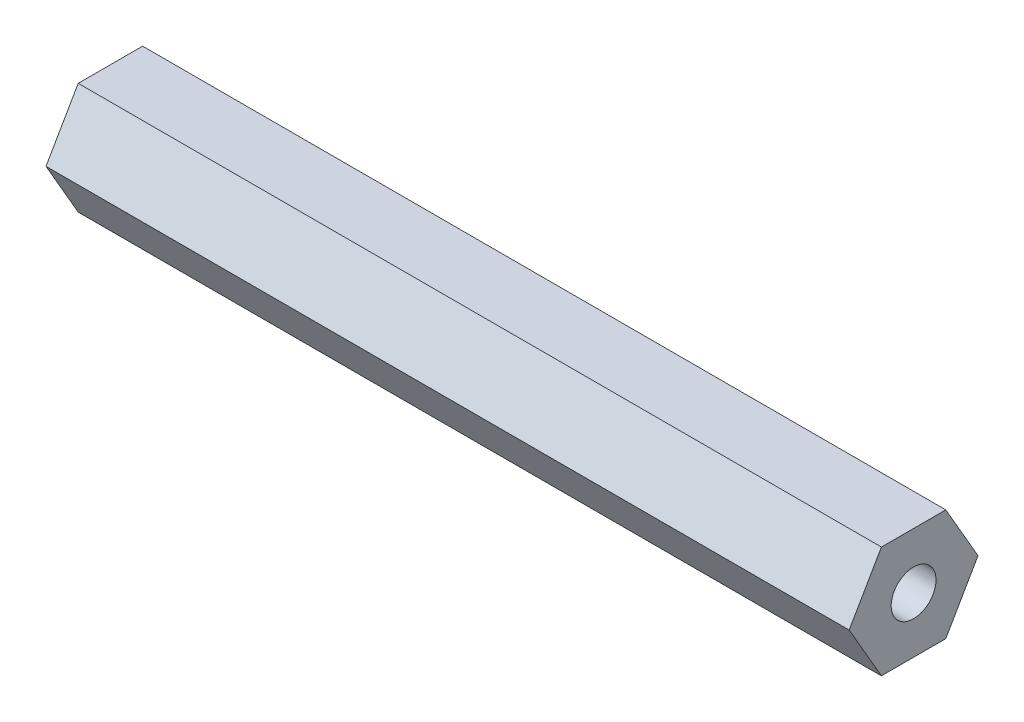
from build123d import *

# Parameters (mm, degrees)
BOSS_EXTRUDE1_DEPTH = 91.44


with BuildPart() as part:
    # Sketch1 → Boss-Extrude1 (new body)
    with BuildSketch(Plane(origin=(0, 0, 0), x_dir=(0, 0, -1), z_dir=(1, 0, 0))):
        Polygon((7.332348419, 0), (3.666174209, 6.35), (-3.666174209, 6.35), (-7.332348419, 0), (-3.666174209, -6.35), (3.666174209, -6.35), align=None)
    extrude(amount=BOSS_EXTRUDE1_DEPTH)

    # Sketch3 → Tap Drill for 1/4-20 Tap1 (revolve, cut)
    with BuildSketch(Plane.ZX):
        Polygon((0, 0), (0, 14.233816902), (2.5527, 12.7), (2.5527, 0), align=None)
    tap_drill_for_1_4_20_tap1 = revolve(axis=Axis((-6.35, 0, 0), (1, 0, 0)), mode=Mode.SUBTRACT)

    # Mirror1: Tap Drill for 1/4-20 Tap1 across plane
    add(tap_drill_for_1_4_20_tap1.mirror(Plane.ZY.offset(-45.72)), mode=Mode.SUBTRACT)


solid = part.part
